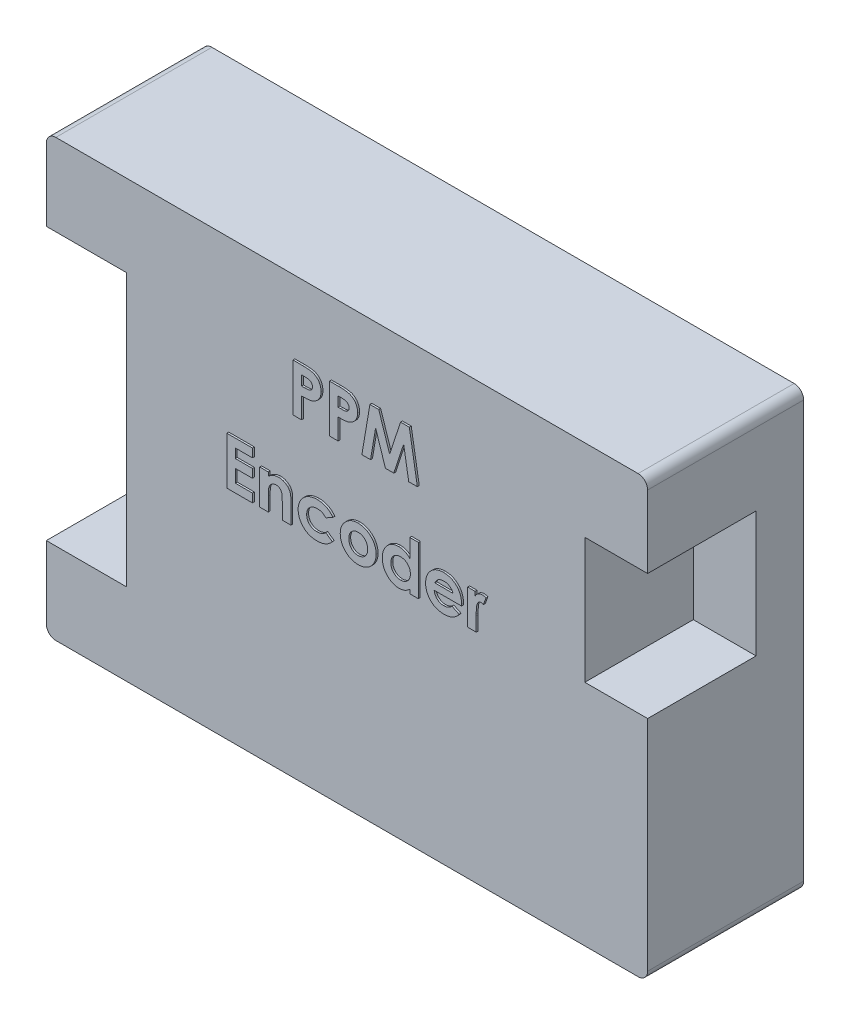
from build123d import *

# Parameters (mm, degrees)
SKETCH1_W           = 31.6
SKETCH1_H           = 22.9
BOSS_EXTRUDE1_DEPTH = 4.1
SKETCH2_W           = 4.2
SKETCH2_H           = 14.3
SKETCH2_W_2         = 3.3
SKETCH2_H_2         = 6.6
CUT_EXTRUDE1_DEPTH  = 5.7
FILLET1_R           = 0.5
BOSS_EXTRUDE2_DEPTH = 0.1


with BuildPart() as part:
    # Sketch1 → Boss-Extrude1 (new, symmetric)
    with BuildSketch(Plane.XY):
        Rectangle(SKETCH1_W, SKETCH1_H)
    extrude(amount=BOSS_EXTRUDE1_DEPTH, both=True)

    # Sketch2 → Cut-Extrude1 (cut)
    with BuildSketch(Plane.XY.offset(4.1)):
        with Locations((-13.7, 0)):
            Rectangle(SKETCH2_W, SKETCH2_H)
        with Locations((14.15, 3.85)):
            Rectangle(SKETCH2_W_2, SKETCH2_H_2)
    extrude(amount=-CUT_EXTRUDE1_DEPTH, mode=Mode.SUBTRACT)

    # Fillet1
    fillet1_edges = [part.edges().sort_by_distance(p)[0] for p in [
        (-15.8, 11.45, 0),
        (-15.8, -11.45, 0),
        (15.8, -11.45, 0),
        (15.8, 11.45, 0),
    ]]
    fillet(fillet1_edges, radius=FILLET1_R)

    # Sketch3 → Boss-Extrude2 (add)
    # profile 1 of 10: a face of its own
    with BuildSketch(Plane.XY.offset(4.1)):
        with BuildLine():
            Line((-2.739102564, 7.649136788), (-2.238301282, 7.649136788))
            add(Edge.make_bspline(
                [(-2.238301282, 7.649136788), (-2.205579576, 7.648990318), (-2.142452546, 7.648707748), (-2.051418175, 7.645281211), (-1.967434511, 7.639140647), (-1.890520848, 7.631551882), (-1.820708812, 7.620912727), (-1.757910976, 7.60871577), (-1.70211431, 7.593856326), (-1.652689622, 7.576218373), (-1.608332561, 7.555423914), (-1.566356475, 7.533276331), (-1.527710028, 7.506843973), (-1.490442617, 7.478975605), (-1.456684884, 7.447008975), (-1.42433082, 7.413071507), (-1.394750708, 7.375817269), (-1.367807483, 7.335697214), (-1.343365828, 7.293452589), (-1.322011962, 7.249007873), (-1.304690902, 7.202292738), (-1.290160686, 7.153609376), (-1.278489876, 7.10295991), (-1.270721413, 7.05003284), (-1.265444682, 6.995197725), (-1.264979083, 6.95787691), (-1.26474359, 6.93900057)],
                knots=[0, 0, 0, 0, 1.698747864, 3.27724071, 4.728299578, 6.070144658, 7.288476769, 8.393259625, 9.389771311, 10.283485332, 11.113357557, 11.931608583, 12.74405601, 13.541433047, 14.344816069, 15.154114104, 15.974336324, 16.810834471, 17.661136416, 18.50621059, 19.367396281, 20.244825668, 21.142564693, 22.063065223, 23.020325768, 24, 24, 24, 24], degree=3))
            add(Edge.make_bspline(
                [(-1.26474359, 6.93900057), (-1.265084319, 6.918118124), (-1.265753894, 6.877081552), (-1.272317884, 6.816926971), (-1.283531253, 6.759575025), (-1.29818654, 6.704542054), (-1.318622296, 6.652733472), (-1.341969187, 6.602913111), (-1.370693268, 6.556477781), (-1.403515123, 6.512846632), (-1.439360333, 6.471664921), (-1.479079862, 6.434121694), (-1.521916638, 6.399961018), (-1.567622695, 6.368824888), (-1.616369628, 6.340776112), (-1.668122262, 6.315552043), (-1.723233994, 6.293959425), (-1.761612146, 6.28266666), (-1.781069712, 6.276941275)],
                knots=[0, 0, 0, 0, 1.102006807, 2.165578795, 3.188629044, 4.184801286, 5.166646146, 6.124351954, 7.085497154, 8.042432466, 9.003981491, 9.963833307, 10.922997304, 11.89326795, 12.880200226, 13.889073926, 14.929769137, 16, 16, 16, 16], degree=3))
            add(Edge.make_bspline(
                [(-1.781069712, 6.276941275), (-1.793885584, 6.273752665), (-1.821648889, 6.26684511), (-1.867589535, 6.259832207), (-1.920531306, 6.253384275), (-1.980645397, 6.247843057), (-2.047966465, 6.24407632), (-2.122429326, 6.241134666), (-2.204067726, 6.23899578), (-2.260835841, 6.238919883), (-2.290384615, 6.238880378)],
                knots=[0, 0, 0, 0, 0.618981996, 1.340914327, 2.176866532, 3.120127938, 4.170906482, 5.338178032, 6.614476169, 8, 8, 8, 8], degree=3))
            Line((-2.290384615, 6.238880378), (-2.290384615, 5.149136788))
            Line((-2.290384615, 5.149136788), (-2.739102564, 5.149136788))
            Line((-2.739102564, 5.149136788), (-2.739102564, 7.649136788))
        make_face()
        with BuildLine():
            Line((-2.290384615, 6.687598326), (-2.131630609, 6.687598326))
            add(Edge.make_bspline(
                [(-2.131630609, 6.687598326), (-2.102742811, 6.687781497), (-2.049588834, 6.688118535), (-1.976999272, 6.692992293), (-1.918664903, 6.700435505), (-1.872579668, 6.711110793), (-1.836191011, 6.727311956), (-1.804808072, 6.746053652), (-1.777890124, 6.769752011), (-1.754583143, 6.796831441), (-1.735949914, 6.827947063), (-1.72302874, 6.86259222), (-1.714635399, 6.90003898), (-1.713860196, 6.926099447), (-1.713461538, 6.939501371)],
                knots=[0, 0, 0, 0, 1.8619151, 3.425951444, 4.686033666, 5.651700536, 6.461346321, 7.243864085, 7.999046032, 8.762387399, 9.539336099, 10.322741239, 11.137448474, 12, 12, 12, 12], degree=3))
            add(Edge.make_bspline(
                [(-1.713461538, 6.939501371), (-1.713856096, 6.951210458), (-1.714621631, 6.973928902), (-1.720245466, 7.006717251), (-1.72920824, 7.037282757), (-1.742194955, 7.065306202), (-1.758983703, 7.090739971), (-1.779452584, 7.113574045), (-1.803338942, 7.134297433), (-1.821780607, 7.14526664), (-1.83114984, 7.150839512)],
                knots=[0, 0, 0, 0, 1.102301479, 2.1387299, 3.123554645, 4.094223062, 5.036071848, 5.982632524, 6.975082478, 8, 8, 8, 8], degree=3))
            add(Edge.make_bspline(
                [(-1.83114984, 7.150839512), (-1.839086121, 7.154853117), (-1.855888854, 7.163350741), (-1.884505538, 7.17322985), (-1.917528754, 7.181563967), (-1.955181447, 7.188481204), (-1.997313408, 7.193849698), (-2.043917121, 7.197955253), (-2.095061168, 7.199606256), (-2.130628792, 7.200140507), (-2.149158654, 7.200418839)],
                knots=[0, 0, 0, 0, 0.656809284, 1.390599849, 2.23162475, 3.173112763, 4.218524733, 5.370385145, 6.63003504, 8, 8, 8, 8], degree=3))
            Line((-2.149158654, 7.200418839), (-2.290384615, 7.200418839))
            Line((-2.290384615, 7.200418839), (-2.290384615, 6.687598326))
        make_face(mode=Mode.SUBTRACT)
    # profile 2 of 10: a face of its own
    with BuildSketch(Plane.XY.offset(4.1)):
        with BuildLine():
            Line((-0.816025641, 7.649136788), (-0.315224359, 7.649136788))
            add(Edge.make_bspline(
                [(-0.315224359, 7.649136788), (-0.282502653, 7.648990318), (-0.219375623, 7.648707748), (-0.128341252, 7.645281211), (-0.044357588, 7.639140647), (0.032556075, 7.631551882), (0.102368111, 7.620912727), (0.165165947, 7.60871577), (0.220962613, 7.593856326), (0.270387301, 7.576218373), (0.314744362, 7.555423914), (0.356720448, 7.533276331), (0.395366895, 7.506843973), (0.432634306, 7.478975605), (0.466392039, 7.447008975), (0.498746103, 7.413071507), (0.528326216, 7.375817269), (0.55526944, 7.335697214), (0.579711095, 7.293452589), (0.601064961, 7.249007873), (0.618386021, 7.202292738), (0.632916237, 7.153609376), (0.644587047, 7.10295991), (0.652355511, 7.05003284), (0.657632241, 6.995197725), (0.65809784, 6.95787691), (0.658333333, 6.93900057)],
                knots=[0, 0, 0, 0, 1.698747864, 3.27724071, 4.728299578, 6.070144658, 7.288476769, 8.393259625, 9.389771311, 10.283485332, 11.113357557, 11.931608583, 12.74405601, 13.541433047, 14.344816069, 15.154114104, 15.974336324, 16.810834471, 17.661136416, 18.50621059, 19.367396281, 20.244825668, 21.142564693, 22.063065223, 23.020325768, 24, 24, 24, 24], degree=3))
            add(Edge.make_bspline(
                [(0.658333333, 6.93900057), (0.657992604, 6.918118124), (0.657323029, 6.877081552), (0.650759039, 6.816926971), (0.63954567, 6.759575025), (0.624890383, 6.704542054), (0.604454628, 6.652733472), (0.581107737, 6.602913111), (0.552383655, 6.556477781), (0.5195618, 6.512846632), (0.48371659, 6.471664921), (0.443997061, 6.434121694), (0.401160285, 6.399961018), (0.355454228, 6.368824888), (0.306707296, 6.340776112), (0.254954661, 6.315552043), (0.199842929, 6.293959425), (0.161464777, 6.28266666), (0.142007212, 6.276941275)],
                knots=[0, 0, 0, 0, 1.102006807, 2.165578795, 3.188629044, 4.184801286, 5.166646146, 6.124351954, 7.085497154, 8.042432466, 9.003981491, 9.963833307, 10.922997304, 11.89326795, 12.880200226, 13.889073926, 14.929769137, 16, 16, 16, 16], degree=3))
            add(Edge.make_bspline(
                [(0.142007212, 6.276941275), (0.129191339, 6.273752665), (0.101428034, 6.26684511), (0.055487388, 6.259832207), (0.002545617, 6.253384275), (-0.057568473, 6.247843057), (-0.124889542, 6.24407632), (-0.199352403, 6.241134666), (-0.280990803, 6.23899578), (-0.337758918, 6.238919883), (-0.367307692, 6.238880378)],
                knots=[0, 0, 0, 0, 0.618981996, 1.340914327, 2.176866532, 3.120127938, 4.170906482, 5.338178032, 6.614476169, 8, 8, 8, 8], degree=3))
            Line((-0.367307692, 6.238880378), (-0.367307692, 5.149136788))
            Line((-0.367307692, 5.149136788), (-0.816025641, 5.149136788))
            Line((-0.816025641, 5.149136788), (-0.816025641, 7.649136788))
        make_face()
        with BuildLine():
            Line((-0.367307692, 6.687598326), (-0.208553686, 6.687598326))
            add(Edge.make_bspline(
                [(-0.208553686, 6.687598326), (-0.179665888, 6.687781497), (-0.126511911, 6.688118535), (-0.053922348, 6.692992293), (0.00441202, 6.700435505), (0.050497255, 6.711110793), (0.086885912, 6.727311956), (0.118268851, 6.746053652), (0.145186799, 6.769752011), (0.168493781, 6.796831441), (0.18712701, 6.827947063), (0.200048183, 6.86259222), (0.208441524, 6.90003898), (0.209216727, 6.926099447), (0.209615385, 6.939501371)],
                knots=[0, 0, 0, 0, 1.8619151, 3.425951444, 4.686033666, 5.651700536, 6.461346321, 7.243864085, 7.999046032, 8.762387399, 9.539336099, 10.322741239, 11.137448474, 12, 12, 12, 12], degree=3))
            add(Edge.make_bspline(
                [(0.209615385, 6.939501371), (0.209220827, 6.951210458), (0.208455292, 6.973928902), (0.202831457, 7.006717251), (0.193868683, 7.037282757), (0.180881968, 7.065306202), (0.16409322, 7.090739971), (0.143624339, 7.113574045), (0.119737981, 7.134297433), (0.101296316, 7.14526664), (0.091927083, 7.150839512)],
                knots=[0, 0, 0, 0, 1.102301479, 2.1387299, 3.123554645, 4.094223062, 5.036071848, 5.982632524, 6.975082478, 8, 8, 8, 8], degree=3))
            add(Edge.make_bspline(
                [(0.091927083, 7.150839512), (0.083990802, 7.154853117), (0.067188069, 7.163350741), (0.038571385, 7.17322985), (0.005548169, 7.181563967), (-0.032104524, 7.188481204), (-0.074236485, 7.193849698), (-0.120840198, 7.197955253), (-0.171984245, 7.199606256), (-0.207551869, 7.200140507), (-0.226081731, 7.200418839)],
                knots=[0, 0, 0, 0, 0.656809284, 1.390599849, 2.23162475, 3.173112763, 4.218524733, 5.370385145, 6.63003504, 8, 8, 8, 8], degree=3))
            Line((-0.226081731, 7.200418839), (-0.367307692, 7.200418839))
            Line((-0.367307692, 7.200418839), (-0.367307692, 6.687598326))
        make_face(mode=Mode.SUBTRACT)
    # profile 3 of 10: a face of its own
    with BuildSketch(Plane.XY.offset(4.1)):
        Polygon((1.304867788, 7.649136788), (1.769611378, 7.649136788), (2.341025641, 5.905346724), (2.915444712, 7.649136788), (3.376682692, 7.649136788), (3.799358974, 5.149136788), (3.345132212, 5.149136788), (3.078205128, 6.72816323), (2.558373397, 5.149136788), (2.121173878, 5.149136788), (1.603846154, 6.72816323), (1.337419872, 5.149136788), (0.882692308, 5.149136788), align=None)
    # profile 4 of 10: a face of its own
    with BuildSketch(Plane.XY.offset(4.1)):
        Polygon((-6.216666667, 2.578623967), (-4.870512821, 2.578623967), (-4.870512821, 2.129906019), (-5.767948718, 2.129906019), (-5.767948718, 1.649136788), (-4.870512821, 1.649136788), (-4.870512821, 1.200418839), (-5.767948718, 1.200418839), (-5.767948718, 0.527341916), (-4.870512821, 0.527341916), (-4.870512821, 0.078623967), (-6.216666667, 0.078623967), align=None)
    # profile 5 of 10: a face of its own
    with BuildSketch(Plane.XY.offset(4.1)):
        with BuildLine():
            Line((-4.485897436, 1.905547044), (-4.037179487, 1.905547044))
            Line((-4.037179487, 1.905547044), (-4.037179487, 1.712237749))
            add(Edge.make_bspline(
                [(-4.037179487, 1.712237749), (-4.011580351, 1.732149285), (-3.962655424, 1.7702041), (-3.888281089, 1.818724184), (-3.818080925, 1.858435924), (-3.750490095, 1.888642705), (-3.684236876, 1.910375186), (-3.61824825, 1.925988676), (-3.551541511, 1.935986424), (-3.506698391, 1.937061314), (-3.484294872, 1.937598326)],
                knots=[0, 0, 0, 0, 1.276643801, 2.439914479, 3.493451431, 4.44993799, 5.350072675, 6.235028322, 7.118224225, 8, 8, 8, 8], degree=3))
            add(Edge.make_bspline(
                [(-3.484294872, 1.937598326), (-3.461569516, 1.936984632), (-3.416957735, 1.935779899), (-3.351269345, 1.927353766), (-3.288510468, 1.91200711), (-3.227975431, 1.891630901), (-3.170280379, 1.864735474), (-3.114718511, 1.832801517), (-3.062483276, 1.793903798), (-3.030314506, 1.764281163), (-3.014042468, 1.749297044)],
                knots=[0, 0, 0, 0, 1.048836932, 2.058954983, 3.049370783, 4.026390553, 5.001981509, 5.982488534, 6.97947532, 8, 8, 8, 8], degree=3))
            add(Edge.make_bspline(
                [(-3.014042468, 1.749297044), (-3.000991694, 1.735411148), (-2.974794631, 1.707537728), (-2.941828918, 1.659839167), (-2.913540629, 1.607839004), (-2.890362306, 1.550937402), (-2.873234459, 1.488821723), (-2.860057773, 1.422242234), (-2.852664105, 1.350826142), (-2.851751322, 1.30176396), (-2.851282051, 1.276540634)],
                knots=[0, 0, 0, 0, 0.889584746, 1.785680191, 2.700364693, 3.65222533, 4.649950538, 5.707241244, 6.821271309, 8, 8, 8, 8], degree=3))
            Line((-2.851282051, 1.276540634), (-2.851282051, 0.078623967))
            Line((-2.851282051, 0.078623967), (-3.3, 0.078623967))
            Line((-3.3, 0.078623967), (-3.3, 0.871893198))
            add(Edge.make_bspline(
                [(-3.3, 0.871893198), (-3.300094894, 0.897768258), (-3.300276741, 0.947353009), (-3.30167292, 1.018316239), (-3.304399076, 1.082405251), (-3.306883897, 1.139736733), (-3.311762586, 1.190107119), (-3.316162268, 1.233835293), (-3.322913152, 1.27052455), (-3.331697148, 1.309989349), (-3.347036169, 1.352243635), (-3.37084925, 1.396765505), (-3.401059483, 1.434587826), (-3.436432961, 1.465975752), (-3.476930617, 1.49080648), (-3.522063096, 1.508276444), (-3.571588434, 1.519164154), (-3.606097107, 1.520327501), (-3.624018429, 1.52093166)],
                knots=[0, 0, 0, 0, 1.49886392, 2.872294502, 4.110984203, 5.214877267, 6.195405875, 7.042225351, 7.75923308, 8.355011229, 9.382752534, 10.352059385, 11.267231453, 12.171456522, 13.078624015, 14.003401117, 14.963110155, 16, 16, 16, 16], degree=3))
            add(Edge.make_bspline(
                [(-3.624018429, 1.52093166), (-3.647325863, 1.519749733), (-3.692919735, 1.517437656), (-3.75886215, 1.500002483), (-3.819429158, 1.470350385), (-3.87412588, 1.429317845), (-3.922431372, 1.378658089), (-3.962217058, 1.318240519), (-3.994849493, 1.249523309), (-4.008881926, 1.199348585), (-4.016145833, 1.17337557)],
                knots=[0, 0, 0, 0, 0.984188326, 1.925263693, 2.85911992, 3.81709677, 4.80007086, 5.801799564, 6.862098548, 8, 8, 8, 8], degree=3))
            add(Edge.make_bspline(
                [(-4.016145833, 1.17337557), (-4.017951203, 1.165218571), (-4.02197754, 1.147026822), (-4.025288693, 1.116293851), (-4.029894748, 1.079832157), (-4.031620523, 1.036981886), (-4.034621456, 0.987945829), (-4.035731345, 0.932659114), (-4.036843219, 0.871230149), (-4.037063684, 0.82832435), (-4.037179487, 0.805787429)],
                knots=[0, 0, 0, 0, 0.543362196, 1.211806945, 2.009705693, 2.934833164, 4.000995085, 5.207458376, 6.533175157, 8, 8, 8, 8], degree=3))
            Line((-4.037179487, 0.805787429), (-4.037179487, 0.078623967))
            Line((-4.037179487, 0.078623967), (-4.485897436, 0.078623967))
            Line((-4.485897436, 0.078623967), (-4.485897436, 1.905547044))
        make_face()
    # profile 6 of 10: a face of its own
    with BuildSketch(Plane.XY.offset(4.1)):
        with BuildLine():
            Line((-0.63974359, 1.53295089), (-1.011338141, 1.328623967))
            add(Edge.make_bspline(
                [(-1.011338141, 1.328623967), (-1.028370681, 1.345680555), (-1.061111505, 1.378467606), (-1.113614047, 1.41997081), (-1.165178438, 1.454334308), (-1.217930464, 1.479692805), (-1.272341665, 1.498790184), (-1.330374588, 1.511438797), (-1.392706578, 1.51976746), (-1.435821686, 1.520535592), (-1.458052885, 1.52093166)],
                knots=[0, 0, 0, 0, 1.150764855, 2.212059359, 3.192108068, 4.105322427, 5.000809612, 5.941206042, 6.938435785, 8, 8, 8, 8], degree=3))
            add(Edge.make_bspline(
                [(-1.458052885, 1.52093166), (-1.478440428, 1.520439225), (-1.51833714, 1.519475572), (-1.576632567, 1.512277746), (-1.632036397, 1.500972707), (-1.684449177, 1.484433394), (-1.733777554, 1.462584062), (-1.780429453, 1.436728663), (-1.82395154, 1.405857322), (-1.863728618, 1.370408867), (-1.899634423, 1.331380903), (-1.931664233, 1.289755902), (-1.957904211, 1.244916367), (-1.980590299, 1.19791619), (-1.997269388, 1.147872602), (-2.009472215, 1.095239697), (-2.016427713, 1.040015144), (-2.017435442, 1.002287339), (-2.017948718, 0.983071083)],
                knots=[0, 0, 0, 0, 1.121765476, 2.195200973, 3.227634963, 4.230038321, 5.213228299, 6.192116585, 7.160777141, 8.14345191, 9.118668839, 10.075979138, 11.027630062, 11.972829041, 12.943187208, 13.923755399, 14.94248691, 16, 16, 16, 16], degree=3))
            add(Edge.make_bspline(
                [(-2.017948718, 0.983071083), (-2.017406398, 0.964356308), (-2.016347479, 0.927814384), (-2.009841839, 0.87412559), (-1.998547804, 0.823016149), (-1.981613877, 0.774756261), (-1.961316672, 0.72890104), (-1.935827098, 0.685815181), (-1.905852763, 0.645310538), (-1.871235865, 0.607739157), (-1.832889126, 0.573948309), (-1.791548335, 0.544107492), (-1.747336835, 0.518808), (-1.699739608, 0.498953584), (-1.649532676, 0.482776389), (-1.596380758, 0.471257593), (-1.540340415, 0.464863864), (-1.502139132, 0.463789227), (-1.482592147, 0.463239352)],
                knots=[0, 0, 0, 0, 1.070556293, 2.090336998, 3.088792742, 4.058148387, 5.011235098, 5.952916408, 6.915475435, 7.888633318, 8.869583867, 9.83422472, 10.800707077, 11.776204622, 12.778807041, 13.814557445, 14.881744048, 16, 16, 16, 16], degree=3))
            add(Edge.make_bspline(
                [(-1.482592147, 0.463239352), (-1.458525124, 0.463790076), (-1.411549793, 0.464865009), (-1.343261293, 0.473982245), (-1.279002749, 0.489058946), (-1.218767347, 0.509926299), (-1.162639356, 0.537210752), (-1.110762994, 0.570536676), (-1.062604973, 0.60965823), (-1.034521869, 0.640158275), (-1.020352564, 0.655547044)],
                knots=[0, 0, 0, 0, 1.116373375, 2.178998604, 3.189797796, 4.174590301, 5.13072713, 6.078291395, 7.030403691, 8, 8, 8, 8], degree=3))
            Line((-1.020352564, 0.655547044), (-0.671794872, 0.416164031))
            add(Edge.make_bspline(
                [(-0.671794872, 0.416164031), (-0.695955217, 0.386624954), (-0.743633821, 0.328331832), (-0.826819763, 0.253194125), (-0.916352963, 0.18863414), (-1.014034125, 0.137103177), (-1.118440691, 0.096116884), (-1.230388497, 0.067143644), (-1.34968819, 0.050088333), (-1.43162112, 0.047763299), (-1.473577724, 0.046572685)],
                knots=[0, 0, 0, 0, 0.997876357, 1.969233105, 2.924898516, 3.881013542, 4.852507933, 5.855329832, 6.901747111, 8, 8, 8, 8], degree=3))
            add(Edge.make_bspline(
                [(-1.473577724, 0.046572685), (-1.51134127, 0.047445666), (-1.585097639, 0.049150695), (-1.692595715, 0.062207995), (-1.793703237, 0.084201241), (-1.888628199, 0.114745339), (-1.977284057, 0.154311382), (-2.059383293, 0.20338806), (-2.135479663, 0.260610238), (-2.204200085, 0.326248231), (-2.26551447, 0.397695895), (-2.319042148, 0.472941645), (-2.365335333, 0.550637296), (-2.401652292, 0.632076062), (-2.431333256, 0.715988583), (-2.451378847, 0.803377912), (-2.46460015, 0.893524213), (-2.465972283, 0.9546445), (-2.466666667, 0.985575089)],
                knots=[0, 0, 0, 0, 1.183377041, 2.311265848, 3.387807024, 4.421911742, 5.431260577, 6.423665966, 7.413571885, 8.409103097, 9.395976332, 10.359992013, 11.300391101, 12.225292883, 13.150239058, 14.085544813, 15.031169026, 16, 16, 16, 16], degree=3))
            add(Edge.make_bspline(
                [(-2.466666667, 0.985575089), (-2.466294681, 1.007124693), (-2.46555789, 1.049807832), (-2.459268032, 1.113197054), (-2.449483126, 1.175510585), (-2.434777568, 1.236311019), (-2.416692327, 1.295893336), (-2.394707269, 1.35424556), (-2.367955219, 1.411066583), (-2.338113228, 1.466839759), (-2.304101668, 1.520092758), (-2.266995761, 1.570802077), (-2.226847788, 1.618657145), (-2.183186109, 1.663211966), (-2.136315163, 1.704785347), (-2.086916331, 1.744220735), (-2.033391091, 1.779484357), (-1.977600188, 1.812638675), (-1.919063039, 1.842152404), (-1.85845245, 1.867626642), (-1.796236805, 1.889270682), (-1.732266977, 1.906672927), (-1.666817536, 1.921015567), (-1.599306099, 1.930117996), (-1.530291208, 1.936515898), (-1.483608943, 1.937235342), (-1.46005609, 1.937598326)],
                knots=[0, 0, 0, 0, 1.00272354, 1.986087015, 2.96193297, 3.936200312, 4.894695956, 5.858592327, 6.835334787, 7.815655071, 8.800643866, 9.773423113, 10.738352213, 11.705312252, 12.673769326, 13.65298065, 14.64420052, 15.654211674, 16.672258995, 17.692438602, 18.712115155, 19.735602823, 20.776372304, 21.827874031, 22.90408564, 24, 24, 24, 24], degree=3))
            add(Edge.make_bspline(
                [(-1.46005609, 1.937598326), (-1.438178511, 1.937350982), (-1.395031299, 1.936863166), (-1.33131262, 1.931762372), (-1.269332057, 1.92309845), (-1.208984131, 1.911636446), (-1.150085566, 1.897433027), (-1.093425759, 1.878500345), (-1.038230074, 1.857012464), (-0.967137449, 1.824568007), (-0.883332257, 1.776139404), (-0.791336608, 1.706682111), (-0.709311351, 1.62542721), (-0.663056097, 1.563940171), (-0.63974359, 1.53295089)],
                knots=[0, 0, 0, 0, 0.826738014, 1.630502179, 2.413926014, 3.191023582, 3.95155221, 4.701751672, 5.446919844, 6.189438973, 7.653650558, 9.094719814, 10.535747635, 12, 12, 12, 12], degree=3))
        make_face()
    # profile 7 of 10: a face of its own
    with BuildSketch(Plane.XY.offset(4.1)):
        with BuildLine():
            add(Edge.make_bspline(
                [(0.679366987, 1.937598326), (0.700581506, 1.937220799), (0.742595865, 1.936473125), (0.805171004, 1.93024942), (0.866652185, 1.920095187), (0.927392795, 1.906947229), (0.986828799, 1.888524973), (1.045271932, 1.866430326), (1.103244751, 1.841063087), (1.159308381, 1.810867199), (1.213867839, 1.778117005), (1.265593454, 1.741990854), (1.314055677, 1.702772505), (1.360154134, 1.661371265), (1.401740562, 1.615984661), (1.441472557, 1.568799608), (1.477203496, 1.518125631), (1.510285198, 1.465197538), (1.5397376, 1.410321402), (1.565311594, 1.35387896), (1.587507417, 1.296650569), (1.604886301, 1.237939148), (1.619274415, 1.178518886), (1.628354338, 1.11766163), (1.634809534, 1.05599254), (1.635533366, 1.014471833), (1.635897436, 0.99358791)],
                knots=[0, 0, 0, 0, 1.022364134, 2.024744242, 3.027414945, 4.024939316, 5.017584196, 6.023349371, 7.035562955, 8.064994934, 9.090267829, 10.101425541, 11.102933353, 12.093946398, 13.084502048, 14.067315274, 15.065326281, 16.070028806, 17.074376865, 18.064572984, 19.055292013, 20.030201733, 21.013838017, 21.999348303, 22.993720005, 24, 24, 24, 24], degree=3))
            add(Edge.make_bspline(
                [(1.635897436, 0.99358791), (1.63551322, 0.972540831), (1.634749312, 0.930694466), (1.628587879, 0.868445302), (1.61839478, 0.807301863), (1.605196359, 0.746903945), (1.586843045, 0.688024395), (1.565399155, 0.629795308), (1.539075938, 0.573010365), (1.509973681, 0.517050098), (1.476679277, 0.463561246), (1.440979268, 0.412379639), (1.40141369, 0.364848009), (1.360160173, 0.31949227), (1.315261969, 0.277846148), (1.267435736, 0.239233423), (1.217095519, 0.203182036), (1.163879316, 0.170537821), (1.108468739, 0.141854513), (1.051798277, 0.115994171), (0.993536553, 0.094463589), (0.933804142, 0.076905993), (0.872564818, 0.063311585), (0.809953783, 0.054076743), (0.746105877, 0.047654016), (0.703087672, 0.046935449), (0.681370192, 0.046572685)],
                knots=[0, 0, 0, 0, 1.012026251, 2.012137606, 3.004615893, 3.992048833, 4.982446996, 5.968083444, 6.973977695, 7.990229942, 8.999482246, 10.001782172, 10.988562221, 11.971415814, 12.948383116, 13.930088534, 14.925840678, 15.924049238, 16.929462851, 17.924729459, 18.917889337, 19.913673841, 20.916777188, 21.931792057, 22.95587778, 24, 24, 24, 24], degree=3))
            add(Edge.make_bspline(
                [(0.681370192, 0.046572685), (0.649614809, 0.047504768), (0.587024464, 0.049341918), (0.494843684, 0.061925915), (0.406288384, 0.083586274), (0.321214264, 0.113780336), (0.239510811, 0.152472901), (0.161891067, 0.200360826), (0.087582927, 0.256501335), (0.017873464, 0.320419924), (-0.045989847, 0.390544403), (-0.101782134, 0.465401858), (-0.1491543, 0.5438703), (-0.188063725, 0.626039211), (-0.218093867, 0.712021265), (-0.239780753, 0.801559407), (-0.252380135, 0.894905316), (-0.254201747, 0.958327218), (-0.255128205, 0.990583102)],
                knots=[0, 0, 0, 0, 1.029999031, 2.030143771, 3.011211297, 3.982305373, 4.953580601, 5.938004764, 6.935448627, 7.970290061, 9.001484052, 10.007591832, 10.993831261, 11.969999897, 12.951306496, 13.942897864, 14.953773953, 16, 16, 16, 16], degree=3))
            add(Edge.make_bspline(
                [(-0.255128205, 0.990583102), (-0.254169439, 1.025025314), (-0.252285004, 1.092720794), (-0.237321757, 1.191896214), (-0.213427067, 1.286851978), (-0.179127744, 1.377322466), (-0.135313376, 1.463474537), (-0.081825963, 1.545126488), (-0.018401165, 1.622296813), (0.030169529, 1.668972072), (0.054867788, 1.692706499)],
                knots=[0, 0, 0, 0, 1.043912699, 2.05178951, 3.033892, 4.007821512, 4.978932272, 5.95884105, 6.962068106, 8, 8, 8, 8], degree=3))
            add(Edge.make_bspline(
                [(0.054867788, 1.692706499), (0.07753091, 1.71237967), (0.122240558, 1.751190764), (0.19487902, 1.800416273), (0.269252608, 1.842932095), (0.346252723, 1.877888008), (0.42609402, 1.904244203), (0.508367358, 1.923429154), (0.593055629, 1.935213114), (0.650450327, 1.936799215), (0.679366987, 1.937598326)],
                knots=[0, 0, 0, 0, 1.048115528, 2.067714963, 3.060638214, 4.039924844, 5.017819947, 5.994373833, 6.98952318, 8, 8, 8, 8], degree=3))
        make_face()
        with BuildLine():
            add(Edge.make_bspline(
                [(0.689383013, 1.52093166), (0.672009885, 1.520354234), (0.637810697, 1.519217567), (0.587468592, 1.513117374), (0.5398545, 1.500614506), (0.494022715, 1.48471428), (0.450784006, 1.463449968), (0.408954219, 1.438565822), (0.37070841, 1.407426376), (0.334195744, 1.373268682), (0.301050381, 1.335337479), (0.272807384, 1.294011461), (0.247571642, 1.250871677), (0.228436657, 1.204338723), (0.212600629, 1.155684482), (0.201882994, 1.104122848), (0.194424269, 1.050229792), (0.193870565, 1.01331268), (0.193589744, 0.994589512)],
                knots=[0, 0, 0, 0, 1.030650113, 2.02884584, 2.99876339, 3.944280128, 4.900564847, 5.851248946, 6.823638398, 7.81794922, 8.81432732, 9.802856497, 10.78262424, 11.771747962, 12.779760563, 13.812642396, 14.89064281, 16, 16, 16, 16], degree=3))
            add(Edge.make_bspline(
                [(0.193589744, 0.994589512), (0.193918343, 0.975206071), (0.194560526, 0.937324858), (0.20121047, 0.882013192), (0.212176448, 0.829522788), (0.227755665, 0.779934732), (0.247349161, 0.732893087), (0.271388108, 0.688661788), (0.300126211, 0.647506781), (0.332708245, 0.609478746), (0.368384181, 0.574960278), (0.407475082, 0.54533782), (0.448343969, 0.519599835), (0.491932682, 0.498928261), (0.537622138, 0.482968129), (0.585547969, 0.47121722), (0.635962025, 0.4648864), (0.670336444, 0.463795917), (0.687880609, 0.463239352)],
                knots=[0, 0, 0, 0, 1.141730614, 2.231293227, 3.276944405, 4.297399982, 5.28939179, 6.275415646, 7.257752684, 8.24146775, 9.222424823, 10.176631434, 11.126518621, 12.063689483, 13.012557477, 13.974037417, 14.965980454, 16, 16, 16, 16], degree=3))
            add(Edge.make_bspline(
                [(0.687880609, 0.463239352), (0.705433548, 0.463733), (0.739847499, 0.464700838), (0.790320758, 0.471948411), (0.838491333, 0.483354663), (0.884571012, 0.499452159), (0.928187237, 0.520566197), (0.969506974, 0.546427315), (1.008893719, 0.576461795), (1.045048429, 0.611631561), (1.078516152, 0.649778192), (1.107865344, 0.691150454), (1.132390636, 0.735381764), (1.152505766, 0.782193819), (1.168115524, 0.831522277), (1.178899957, 0.883550484), (1.18636267, 0.938117203), (1.186903852, 0.975532931), (1.187179487, 0.994589512)],
                knots=[0, 0, 0, 0, 1.031504075, 2.022346795, 2.991027682, 3.937587355, 4.885570121, 5.833146507, 6.798790848, 7.791235734, 8.792807298, 9.778388351, 10.766749885, 11.760164525, 12.768777521, 13.802286646, 14.880660483, 16, 16, 16, 16], degree=3))
            add(Edge.make_bspline(
                [(1.187179487, 0.994589512), (1.186846708, 1.013639433), (1.186193688, 1.051021558), (1.179543269, 1.105662077), (1.168684909, 1.157522115), (1.152904754, 1.206380233), (1.133427719, 1.252793827), (1.109372156, 1.29652532), (1.080492326, 1.337359326), (1.047751902, 1.375093366), (1.011541162, 1.409127462), (0.973128973, 1.439477613), (0.931636967, 1.46457952), (0.887843558, 1.485272453), (0.841632234, 1.50119271), (0.793054874, 1.513010214), (0.741962604, 1.519250949), (0.707092717, 1.520365568), (0.689383013, 1.52093166)],
                knots=[0, 0, 0, 0, 1.123894411, 2.205445421, 3.243160173, 4.246488011, 5.231014757, 6.210004299, 7.185865357, 8.177612767, 9.153374344, 10.115157457, 11.061423229, 12.009021698, 12.96873347, 13.94135618, 14.954456845, 16, 16, 16, 16], degree=3))
        make_face(mode=Mode.SUBTRACT)
    # profile 8 of 10: a face of its own
    with BuildSketch(Plane.XY.offset(4.1)):
        with BuildLine():
            Line((3.398717949, 2.642726531), (3.847435897, 2.642726531))
            Line((3.847435897, 2.642726531), (3.847435897, 0.078623967))
            Line((3.847435897, 0.078623967), (3.398717949, 0.078623967))
            Line((3.398717949, 0.078623967), (3.398717949, 0.277942878))
            add(Edge.make_bspline(
                [(3.398717949, 0.277942878), (3.37648414, 0.258541388), (3.333332707, 0.220886927), (3.265340012, 0.172029307), (3.197148635, 0.131728085), (3.128430914, 0.09963036), (3.058130686, 0.075929493), (2.985741818, 0.058769512), (2.910221834, 0.048649851), (2.858884389, 0.047272286), (2.8328125, 0.046572685)],
                knots=[0, 0, 0, 0, 1.129196829, 2.191548051, 3.199897424, 4.157751732, 5.089409408, 6.034969131, 7.002052659, 8, 8, 8, 8], degree=3))
            add(Edge.make_bspline(
                [(2.8328125, 0.046572685), (2.803545646, 0.047231098), (2.745712683, 0.048532159), (2.66084923, 0.062227923), (2.57890513, 0.083192342), (2.499946897, 0.112859616), (2.424118191, 0.151302586), (2.350838689, 0.197518223), (2.281364628, 0.253128971), (2.215117659, 0.315728695), (2.154462331, 0.384588837), (2.101436871, 0.458753627), (2.056740349, 0.537171202), (2.02012288, 0.619581571), (1.991318513, 0.70592425), (1.97078512, 0.796473091), (1.958670395, 0.891260435), (1.957170933, 0.955825861), (1.956410256, 0.988579897)],
                knots=[0, 0, 0, 0, 0.980476535, 1.937477201, 2.874147792, 3.812856188, 4.758993464, 5.720109578, 6.712210464, 7.737600662, 8.772720504, 9.783789959, 10.789002326, 11.793715968, 12.802552247, 13.835794126, 14.902098527, 16, 16, 16, 16], degree=3))
            add(Edge.make_bspline(
                [(1.956410256, 0.988579897), (1.95720859, 1.022496744), (1.958774609, 1.089028418), (1.970229947, 1.186660488), (1.990384421, 1.27945448), (2.017866495, 1.367538929), (2.053217412, 1.450929052), (2.096272466, 1.529761469), (2.147617382, 1.603830124), (2.206783296, 1.671874317), (2.27066795, 1.734240107), (2.339013237, 1.788534472), (2.410750385, 1.834660062), (2.485955627, 1.872316444), (2.564618224, 1.901415389), (2.646427617, 1.922689095), (2.731746982, 1.935454065), (2.789867226, 1.936877637), (2.819290865, 1.937598326)],
                knots=[0, 0, 0, 0, 1.136281865, 2.228943489, 3.287578264, 4.313574083, 5.316051562, 6.317280042, 7.318008486, 8.329309503, 9.333984563, 10.305318864, 11.248632312, 12.186624717, 13.117503092, 14.05354244, 15.014596925, 16, 16, 16, 16], degree=3))
            add(Edge.make_bspline(
                [(2.819290865, 1.937598326), (2.846529118, 1.936734143), (2.900392765, 1.93502522), (2.979958648, 1.924267977), (3.056516139, 1.904013028), (3.130995026, 1.877916015), (3.202428058, 1.842798337), (3.271199011, 1.800613599), (3.337489087, 1.750826064), (3.378050309, 1.712324604), (3.398717949, 1.692706499)],
                knots=[0, 0, 0, 0, 1.011899165, 2.001030639, 2.974036179, 3.948778736, 4.92769327, 5.924124564, 6.942254589, 8, 8, 8, 8], degree=3))
            Line((3.398717949, 1.692706499), (3.398717949, 2.642726531))
        make_face()
        with BuildLine():
            add(Edge.make_bspline(
                [(2.913441506, 1.52093166), (2.895561419, 1.520383037), (2.860517615, 1.519307772), (2.808980905, 1.512839979), (2.759727271, 1.501443439), (2.713107986, 1.484607498), (2.66842825, 1.46409887), (2.626366534, 1.438412151), (2.586575688, 1.408050994), (2.549289727, 1.373750444), (2.515298079, 1.336047867), (2.485995296, 1.294906188), (2.461092663, 1.251433939), (2.440031509, 1.205500416), (2.4249565, 1.156562083), (2.4130171, 1.105256029), (2.406821324, 1.05116311), (2.405698225, 1.014300461), (2.405128205, 0.995591115)],
                knots=[0, 0, 0, 0, 1.04836806, 2.054732945, 3.03993516, 4.00574415, 4.955904794, 5.917688631, 6.888591924, 7.88601754, 8.884115178, 9.859153345, 10.841239365, 11.818093293, 12.814750328, 13.83810466, 14.90274714, 16, 16, 16, 16], degree=3))
            add(Edge.make_bspline(
                [(2.405128205, 0.995591115), (2.405689518, 0.976712064), (2.406795578, 0.939511114), (2.413117279, 0.884961902), (2.424627051, 0.832906388), (2.441419374, 0.783765403), (2.461926695, 0.736875874), (2.486888716, 0.692454201), (2.517550188, 0.651285813), (2.551571632, 0.61239653), (2.589622509, 0.577669909), (2.629638508, 0.546835858), (2.672166215, 0.521037027), (2.716744236, 0.500186248), (2.763222518, 0.483194617), (2.812183759, 0.471941308), (2.863148321, 0.464747281), (2.897892208, 0.463745466), (2.915444712, 0.463239352)],
                knots=[0, 0, 0, 0, 1.099136573, 2.165835871, 3.191374663, 4.196217796, 5.183857741, 6.167377911, 7.154730987, 8.166690795, 9.170734848, 10.148332609, 11.103258353, 12.059567475, 13.009337315, 13.978056681, 14.978520572, 16, 16, 16, 16], degree=3))
            add(Edge.make_bspline(
                [(2.915444712, 0.463239352), (2.933657837, 0.46379105), (2.969365463, 0.464872679), (3.021742968, 0.471281447), (3.071658255, 0.482719773), (3.118903649, 0.499652103), (3.16420078, 0.52001352), (3.207140881, 0.545198302), (3.247257987, 0.575489788), (3.284755274, 0.610100416), (3.319114308, 0.648110857), (3.348822326, 0.689792044), (3.374699097, 0.733810899), (3.395049987, 0.781208189), (3.411211447, 0.831154682), (3.422806922, 0.883960356), (3.429114188, 0.939682142), (3.430210575, 0.977714433), (3.430769231, 0.997093519)],
                knots=[0, 0, 0, 0, 1.050008698, 2.058587853, 3.036635738, 3.995319155, 4.947022481, 5.895997462, 6.858296291, 7.838991643, 8.833936038, 9.806048392, 10.784806122, 11.771666913, 12.772873988, 13.80724452, 14.882696879, 16, 16, 16, 16], degree=3))
            add(Edge.make_bspline(
                [(3.430769231, 0.997093519), (3.430217516, 1.016139293), (3.429139858, 1.053341224), (3.42277972, 1.107899566), (3.411101924, 1.159668378), (3.395273093, 1.208742817), (3.374560155, 1.255010676), (3.348663805, 1.297958955), (3.319281667, 1.339075649), (3.284542229, 1.376059217), (3.247248073, 1.410419238), (3.20654098, 1.439794688), (3.163703443, 1.465111265), (3.118472267, 1.485897152), (3.070428633, 1.501133995), (3.020428044, 1.512931324), (2.967690387, 1.51930389), (2.93181956, 1.520380215), (2.913441506, 1.52093166)],
                knots=[0, 0, 0, 0, 1.106611376, 2.161533483, 3.185006901, 4.184773755, 5.152708835, 6.122342771, 7.094156588, 8.082475533, 9.064254463, 10.03606828, 10.992420271, 11.951521816, 12.920622147, 13.915721683, 14.932141191, 16, 16, 16, 16], degree=3))
        make_face(mode=Mode.SUBTRACT)
    # profile 9 of 10: a face of its own
    with BuildSketch(Plane.XY.offset(4.1)):
        with BuildLine():
            Line((6.121574519, 0.879906019), (4.680769231, 0.879906019))
            add(Edge.make_bspline(
                [(4.680769231, 0.879906019), (4.683706916, 0.863164678), (4.6894797, 0.830266624), (4.702015506, 0.782479346), (4.718013075, 0.737445422), (4.737185153, 0.695104652), (4.7592085, 0.655233198), (4.784896909, 0.618018072), (4.813924547, 0.583492144), (4.846123584, 0.55180547), (4.88095732, 0.523413522), (4.918256824, 0.498540382), (4.958060587, 0.478145928), (4.999912274, 0.460955519), (5.044124614, 0.447338975), (5.090762675, 0.437947903), (5.139702827, 0.432400562), (5.173042354, 0.431598203), (5.190084135, 0.43118807)],
                knots=[0, 0, 0, 0, 1.091296461, 2.144483647, 3.168565212, 4.157007626, 5.126487748, 6.090021542, 7.05641414, 8.019231907, 8.98705074, 9.938580405, 10.892824166, 11.854447369, 12.841318655, 13.858982407, 14.905600794, 16, 16, 16, 16], degree=3))
            add(Edge.make_bspline(
                [(5.190084135, 0.43118807), (5.210654721, 0.431731153), (5.251164262, 0.432800644), (5.310511042, 0.442285441), (5.367908023, 0.45661181), (5.422812028, 0.477916323), (5.475859033, 0.504436697), (5.526175721, 0.53747782), (5.574633035, 0.576074121), (5.604197708, 0.605824136), (5.619270833, 0.620991756)],
                knots=[0, 0, 0, 0, 1.021034703, 2.010718019, 2.977989445, 3.954245119, 4.929443971, 5.918328161, 6.938689359, 8, 8, 8, 8], degree=3))
            Line((5.619270833, 0.620991756), (5.994871795, 0.442205698))
            add(Edge.make_bspline(
                [(5.994871795, 0.442205698), (5.983046218, 0.425864565), (5.959614272, 0.393485212), (5.921362406, 0.3479191), (5.881444149, 0.305404068), (5.839829728, 0.266219746), (5.796466368, 0.230477792), (5.751474693, 0.197742805), (5.704197169, 0.168893706), (5.655579103, 0.142534794), (5.604615467, 0.119937421), (5.551447301, 0.100667179), (5.496299803, 0.083247044), (5.438476578, 0.069973855), (5.37845912, 0.059466907), (5.316103855, 0.052005583), (5.251419002, 0.04739708), (5.207453084, 0.046850747), (5.185076122, 0.046572685)],
                knots=[0, 0, 0, 0, 1.028154879, 2.037251081, 3.030720504, 4.000128189, 4.949298328, 5.894184978, 6.834267904, 7.770992897, 8.712077017, 9.673380525, 10.653304757, 11.658697181, 12.695551717, 13.758623199, 14.859225354, 16, 16, 16, 16], degree=3))
            add(Edge.make_bspline(
                [(5.185076122, 0.046572685), (5.150649533, 0.04727454), (5.083227042, 0.048649082), (4.984609461, 0.061406796), (4.890950112, 0.082560462), (4.801984533, 0.111315622), (4.718097292, 0.149281441), (4.639246875, 0.195716788), (4.564645452, 0.249731403), (4.496572513, 0.31245891), (4.434556058, 0.380734072), (4.380084659, 0.454056934), (4.334503769, 0.531915216), (4.297071825, 0.613793636), (4.267978417, 0.699901771), (4.247003758, 0.790277197), (4.234146041, 0.884876749), (4.232757343, 0.949309604), (4.232051282, 0.98206948)],
                knots=[0, 0, 0, 0, 1.103565453, 2.161269334, 3.182010356, 4.179077853, 5.15417608, 6.128274628, 7.109042802, 8.101804412, 9.090965879, 10.063106201, 11.02526161, 11.978650795, 12.945248442, 13.93468508, 14.949922959, 16, 16, 16, 16], degree=3))
            add(Edge.make_bspline(
                [(4.232051282, 0.98206948), (4.232764293, 1.015661827), (4.234167109, 1.081753261), (4.246893053, 1.178537159), (4.268036405, 1.270882089), (4.297214917, 1.358915219), (4.334079014, 1.442911878), (4.380239843, 1.522137198), (4.434529027, 1.596866996), (4.496322069, 1.666751681), (4.564683386, 1.729830243), (4.637323743, 1.786045848), (4.715059331, 1.832888422), (4.797010891, 1.870737192), (4.882654233, 1.901488363), (4.972979275, 1.921950698), (5.067298779, 1.935689932), (5.131773515, 1.936955229), (5.164543269, 1.937598326)],
                knots=[0, 0, 0, 0, 1.079208495, 2.12329425, 3.130605359, 4.119693003, 5.099659317, 6.073216462, 7.060498243, 8.06384408, 9.066070512, 10.045757761, 11.010926815, 11.975797609, 12.942977511, 13.929384301, 14.947594487, 16, 16, 16, 16], degree=3))
            add(Edge.make_bspline(
                [(5.164543269, 1.937598326), (5.199134785, 1.936885583), (5.267051662, 1.935486185), (5.366356084, 1.92283206), (5.46063732, 1.901549401), (5.550297061, 1.873042882), (5.634190315, 1.834118006), (5.714160472, 1.78882536), (5.788289393, 1.733643178), (5.857367215, 1.671222639), (5.919724066, 1.601969215), (5.974230863, 1.526738785), (6.020609439, 1.446265555), (6.058199735, 1.360223188), (6.087263269, 1.268869993), (6.108257344, 1.172324608), (6.121016988, 1.070219823), (6.122379844, 1.000302824), (6.123076923, 0.964541435)],
                knots=[0, 0, 0, 0, 1.080001299, 2.120471247, 3.119684163, 4.095710327, 5.052285597, 6.002875087, 6.961153713, 7.931888285, 8.906493152, 9.865905668, 10.82813294, 11.801621613, 12.7925306, 13.817193356, 14.883530496, 16, 16, 16, 16], degree=3))
            Line((6.123076923, 0.964541435), (6.121574519, 0.879906019))
        make_face()
        with BuildLine():
            add(Edge.make_bspline(
                [(5.674358974, 1.232470121), (5.665891392, 1.255320695), (5.649055633, 1.300753589), (5.611024354, 1.363439897), (5.560558063, 1.417728786), (5.501862147, 1.465791169), (5.434798387, 1.504801602), (5.361480081, 1.533046422), (5.282833957, 1.549982371), (5.228729661, 1.55196866), (5.201101763, 1.552982942)],
                knots=[0, 0, 0, 0, 0.954238005, 1.897273737, 2.851915805, 3.847685534, 4.862635127, 5.880135777, 6.917509367, 8, 8, 8, 8], degree=3))
            add(Edge.make_bspline(
                [(5.201101763, 1.552982942), (5.1709276, 1.552008601), (5.111943394, 1.550103967), (5.026862692, 1.529847486), (4.946608196, 1.499615293), (4.899294693, 1.468445261), (4.875580929, 1.452822685)],
                knots=[0, 0, 0, 0, 1.044195649, 2.041185066, 3.018232172, 4, 4, 4, 4], degree=3))
            add(Edge.make_bspline(
                [(4.875580929, 1.452822685), (4.860785312, 1.440924189), (4.829241812, 1.415557204), (4.788276177, 1.364952477), (4.747924686, 1.303681512), (4.724982639, 1.257141886), (4.712820513, 1.232470121)],
                knots=[0, 0, 0, 0, 0.82159062, 1.751589201, 2.808063854, 4, 4, 4, 4], degree=3))
            Line((4.712820513, 1.232470121), (5.674358974, 1.232470121))
        make_face(mode=Mode.SUBTRACT)
    # profile 10 of 10: a face of its own
    with BuildSketch(Plane.XY.offset(4.1)):
        with BuildLine():
            Line((6.443589744, 1.905547044), (6.828205128, 1.905547044))
            Line((6.828205128, 1.905547044), (6.828205128, 1.680687269))
            add(Edge.make_bspline(
                [(6.828205128, 1.680687269), (6.839085159, 1.700670619), (6.860350631, 1.739728906), (6.899417086, 1.792156921), (6.944298212, 1.836310333), (6.993381291, 1.873112649), (7.046815084, 1.901796442), (7.10316873, 1.92223726), (7.161960124, 1.935520959), (7.20206562, 1.936900885), (7.222335737, 1.937598326)],
                knots=[0, 0, 0, 0, 1.09866127, 2.147379032, 3.14564304, 4.131443017, 5.102343063, 6.064490016, 7.021754664, 8, 8, 8, 8], degree=3))
            add(Edge.make_bspline(
                [(7.222335737, 1.937598326), (7.237054372, 1.936909108), (7.267026767, 1.935505614), (7.312708915, 1.927347081), (7.359050177, 1.912594902), (7.38954672, 1.899312526), (7.405128205, 1.892526211)],
                knots=[0, 0, 0, 0, 0.931404136, 1.896671404, 2.925354185, 4, 4, 4, 4], degree=3))
            Line((7.405128205, 1.892526211), (7.265905449, 1.512418038))
            add(Edge.make_bspline(
                [(7.265905449, 1.512418038), (7.253460922, 1.518430631), (7.230070003, 1.529731992), (7.196110451, 1.543068763), (7.165290748, 1.551206208), (7.145751623, 1.552420386), (7.136698718, 1.552982942)],
                knots=[0, 0, 0, 0, 1.214386998, 2.282580073, 3.20428172, 4, 4, 4, 4], degree=3))
            add(Edge.make_bspline(
                [(7.136698718, 1.552982942), (7.128151015, 1.552610163), (7.111336211, 1.551876842), (7.086518031, 1.545592536), (7.063144473, 1.534755445), (7.040089167, 1.520872056), (7.019170921, 1.501573107), (6.998265597, 1.479231147), (6.979842705, 1.451647025), (6.960401211, 1.420944496), (6.943847475, 1.383364629), (6.929653155, 1.338502012), (6.917005903, 1.285837554), (6.908302866, 1.225091632), (6.899891032, 1.156852068), (6.894884102, 1.080617991), (6.891152373, 0.996630463), (6.890924203, 0.938004136), (6.890805288, 0.907450089)],
                knots=[0, 0, 0, 0, 0.544232178, 1.070598461, 1.618251235, 2.182094276, 2.777567932, 3.425210017, 4.127676488, 4.886675562, 5.738955394, 6.734782583, 7.883056018, 9.186093582, 10.642914445, 12.264202625, 14.053029461, 16, 16, 16, 16], degree=3))
            Line((6.890805288, 0.907450089), (6.892307692, 0.818307461))
            Line((6.892307692, 0.818307461), (6.892307692, 0.078623967))
            Line((6.892307692, 0.078623967), (6.443589744, 0.078623967))
            Line((6.443589744, 0.078623967), (6.443589744, 1.905547044))
        make_face()
    extrude(amount=BOSS_EXTRUDE2_DEPTH)


solid = part.part
